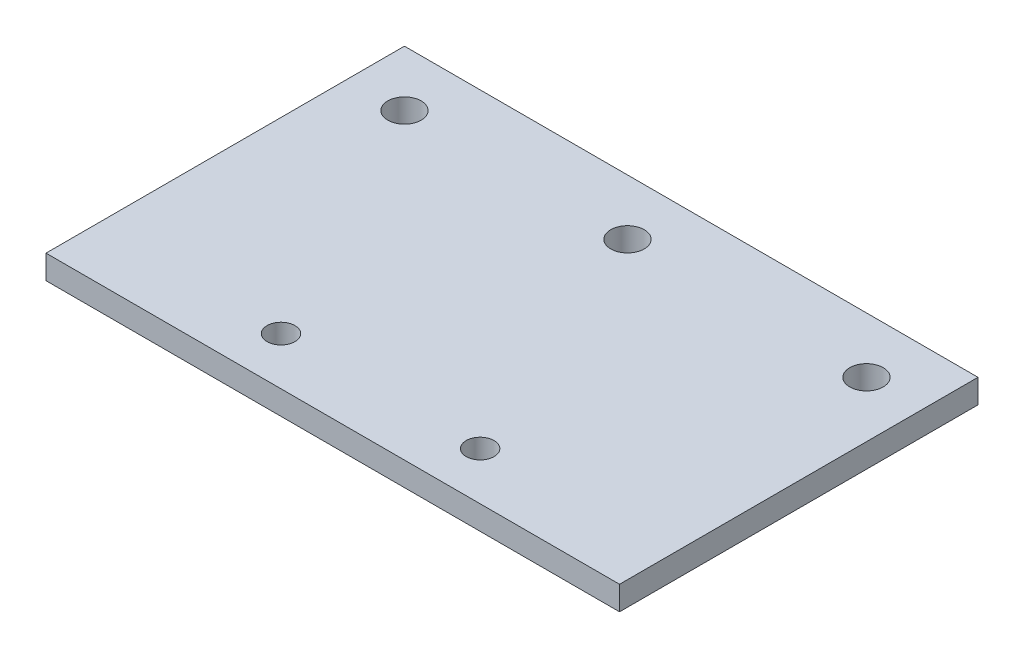
from build123d import *

# Parameters (mm, degrees)
SKETCH1_W           = 72
SKETCH1_H           = 45
SKETCH1_R           = 2.1
SKETCH1_R_2         = 1.75
BOSS_EXTRUDE1_DEPTH = 3


with BuildPart() as part:
    # Sketch1 → Boss-Extrude1 (new body)
    with BuildSketch(Plane(origin=(0, 0, 0), x_dir=(1, 0, 0), z_dir=(0, 1, 0))):
        with Locations((36, -22.5)):
            Rectangle(SKETCH1_W, SKETCH1_H)
        with Locations(Location((7, -7, 0), (0, 0, 270))):
            Circle(SKETCH1_R, mode=Mode.SUBTRACT)
        with Locations(Location((35, -7, 0), (0, 0, 270))):
            Circle(SKETCH1_R, mode=Mode.SUBTRACT)
        with Locations(Location((65, -7, 0), (0, 0, 270))):
            Circle(SKETCH1_R, mode=Mode.SUBTRACT)
        with Locations(Location((23.5, -39, 0), (0, 0, 270))):
            Circle(SKETCH1_R_2, mode=Mode.SUBTRACT)
        with Locations(Location((48.5, -39, 0), (0, 0, 270))):
            Circle(SKETCH1_R_2, mode=Mode.SUBTRACT)
    extrude(amount=BOSS_EXTRUDE1_DEPTH)


solid = part.part
